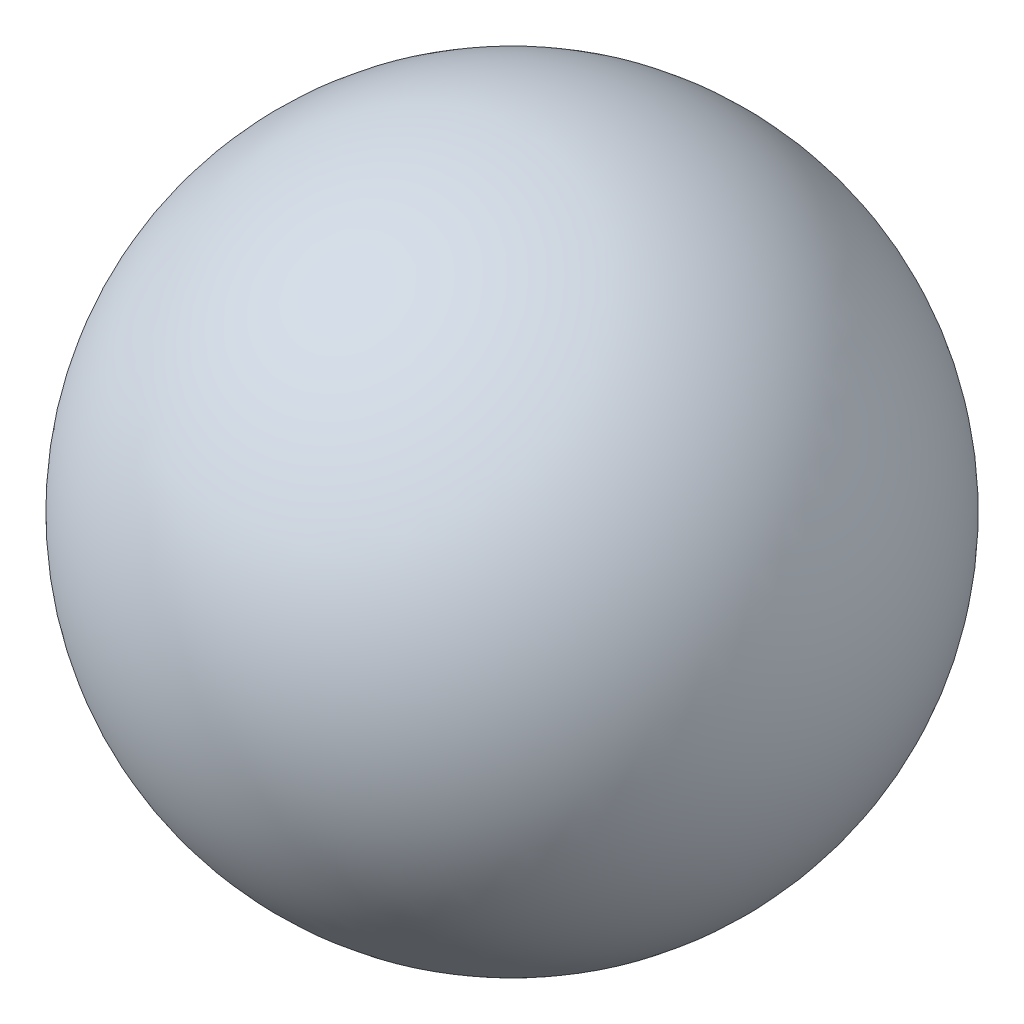
from build123d import *


with BuildPart() as part:
    # Sketch1 → Revolve1 (revolve)
    with BuildSketch(Plane.XY):
        with BuildLine():
            Line((0, 44), (0, 0))
            ThreePointArc((0, 0), (22, 22), (0, 44))
        make_face()
    revolve(axis=Axis((0, 44, 0), (0, -1, 0)))


solid = part.part
